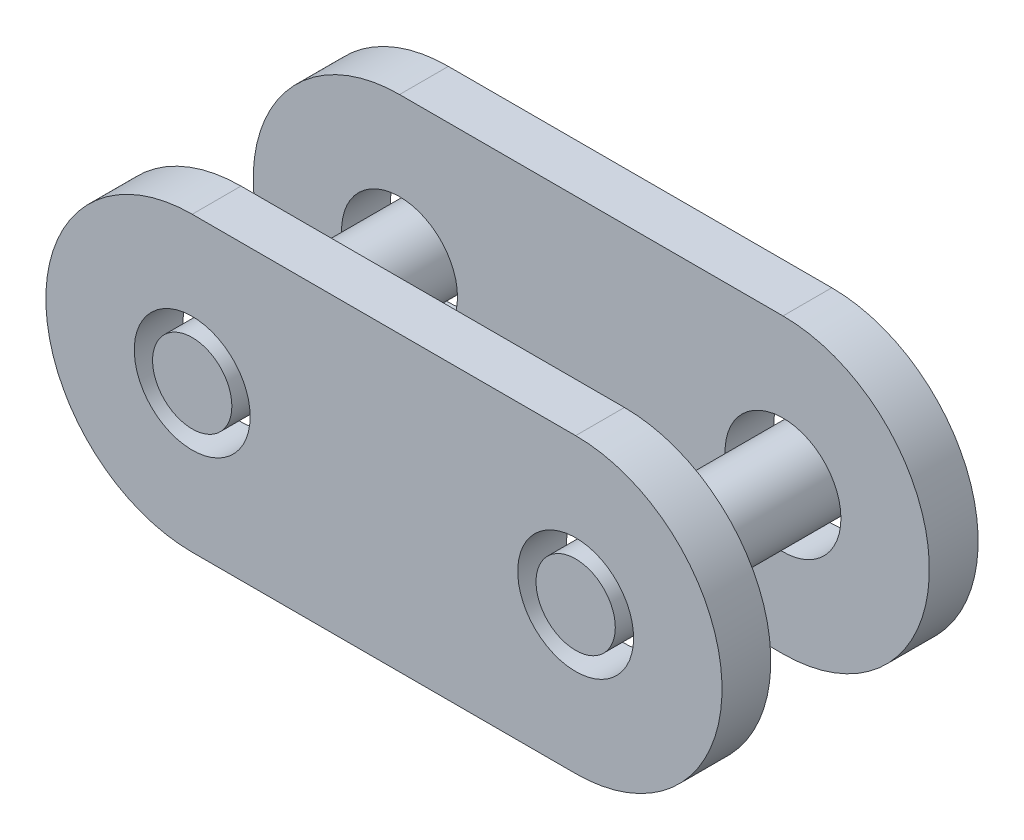
from build123d import *

# Parameters (mm, degrees)
BOSS_EXTRUDE1_START   = 1.3
SKETCH1_R             = 0.95
BOSS_EXTRUDE1_DEPTH   = 0.8
BOSS_EXTRUDE2_START   = -2.1
SKETCH2_R             = 0.95
BOSS_EXTRUDE2_DEPTH   = 0.8
BOSS_EXTRUDE3_START   = -2.1
SKETCH3_R             = 0.65
BOSS_EXTRUDE3_DEPTH   = 4.2
BOSS_EXTRUDE3_2_DEPTH = 4.2


with BuildPart() as part:
    # Sketch1 → Boss-Extrude1 (new body)
    with BuildSketch(Plane.XY.offset(BOSS_EXTRUDE1_START)):
        with BuildLine():
            Line((0, -2.4), (6.287642552, -2.4))
            ThreePointArc((6.287642552, -2.4), (8.687642552, 0), (6.287642552, 2.4))
            Line((6.287642552, 2.4), (0, 2.4))
            ThreePointArc((0, 2.4), (-2.4, 0), (0, -2.4))
        make_face()
        Circle(SKETCH1_R, mode=Mode.SUBTRACT)
        with Locations((6.287642552, 0)):
            Circle(SKETCH1_R, mode=Mode.SUBTRACT)
    extrude(amount=BOSS_EXTRUDE1_DEPTH)


with BuildPart() as body_2:
    # Sketch2 → Boss-Extrude2 (new body)
    with BuildSketch(Plane.XY.offset(BOSS_EXTRUDE2_START)):
        with BuildLine():
            Line((0, -2.4), (6.287642552, -2.4))
            ThreePointArc((6.287642552, -2.4), (8.687642552, 0), (6.287642552, 2.4))
            Line((6.287642552, 2.4), (0, 2.4))
            ThreePointArc((0, 2.4), (-2.4, 0), (0, -2.4))
        make_face()
        Circle(SKETCH2_R, mode=Mode.SUBTRACT)
        with Locations((6.287642552, 0)):
            Circle(SKETCH2_R, mode=Mode.SUBTRACT)
    extrude(amount=BOSS_EXTRUDE2_DEPTH)


with BuildPart() as body_3:
    # Sketch3 → Boss-Extrude3 (new body)
    with BuildSketch(Plane.XY.offset(BOSS_EXTRUDE3_START)):
        Circle(SKETCH3_R)
    extrude(amount=BOSS_EXTRUDE3_DEPTH)


with BuildPart() as body_4:
    # Sketch3 → Boss-Extrude3 2 (new body)
    with BuildSketch(Plane.XY.offset(BOSS_EXTRUDE3_START)):
        with Locations((6.287642552, 0)):
            Circle(SKETCH3_R)
    extrude(amount=BOSS_EXTRUDE3_2_DEPTH)


solid = Compound([part.part, body_2.part, body_3.part, body_4.part])
